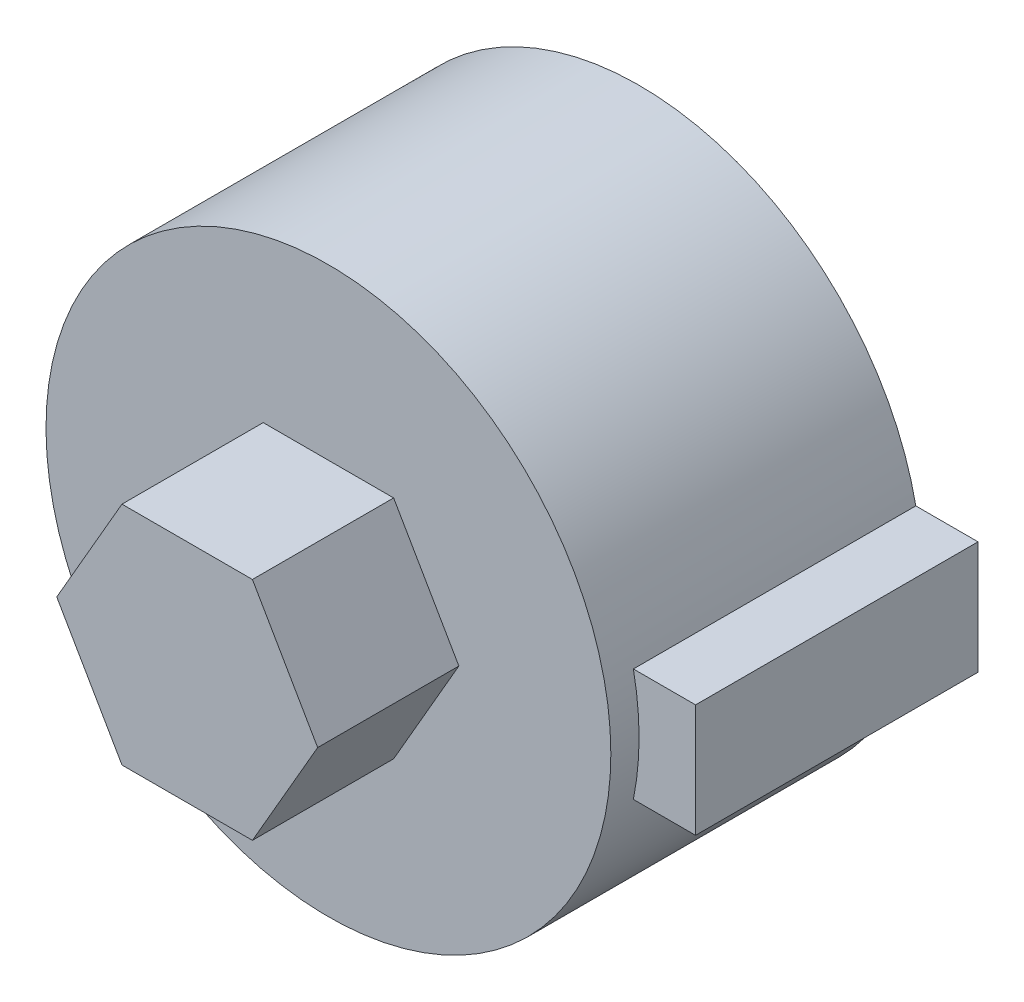
from build123d import *

# Parameters (mm, degrees)
SKETCH1_R           = 5
BOSS_EXTRUDE1_DEPTH = 10
SKETCH2_R           = 10
BOSS_EXTRUDE2_DEPTH = 1
BOSS_EXTRUDE3_DEPTH = 5


with BuildPart() as part:
    # Sketch1 → Boss-Extrude1 (new body)
    with BuildSketch(Plane.XY):
        with BuildLine():
            Line((12, 2), (12, -2))
            Line((12, -2), (9.797958971, -2))
            ThreePointArc((9.797958971, -2), (-10, 0), (9.797958971, 2))
            Line((9.797958971, 2), (12, 2))
        make_face()
        Circle(SKETCH1_R, mode=Mode.SUBTRACT)
    extrude(amount=BOSS_EXTRUDE1_DEPTH)

    # Sketch2 → Boss-Extrude2 (add)
    with BuildSketch(Plane.XY.offset(10)):
        with Locations(Location((0, 0, 0), (0, 0, 348.463040967))):
            Circle(SKETCH2_R)
    extrude(amount=BOSS_EXTRUDE2_DEPTH)

    # Sketch3 → Boss-Extrude3 (add)
    with BuildSketch(Plane.XY.offset(11)):
        Polygon((4.618802154, 0), (2.309401077, 4), (-2.309401077, 4), (-4.618802154, 0), (-2.309401077, -4), (2.309401077, -4), align=None)
    extrude(amount=BOSS_EXTRUDE3_DEPTH)


solid = part.part
